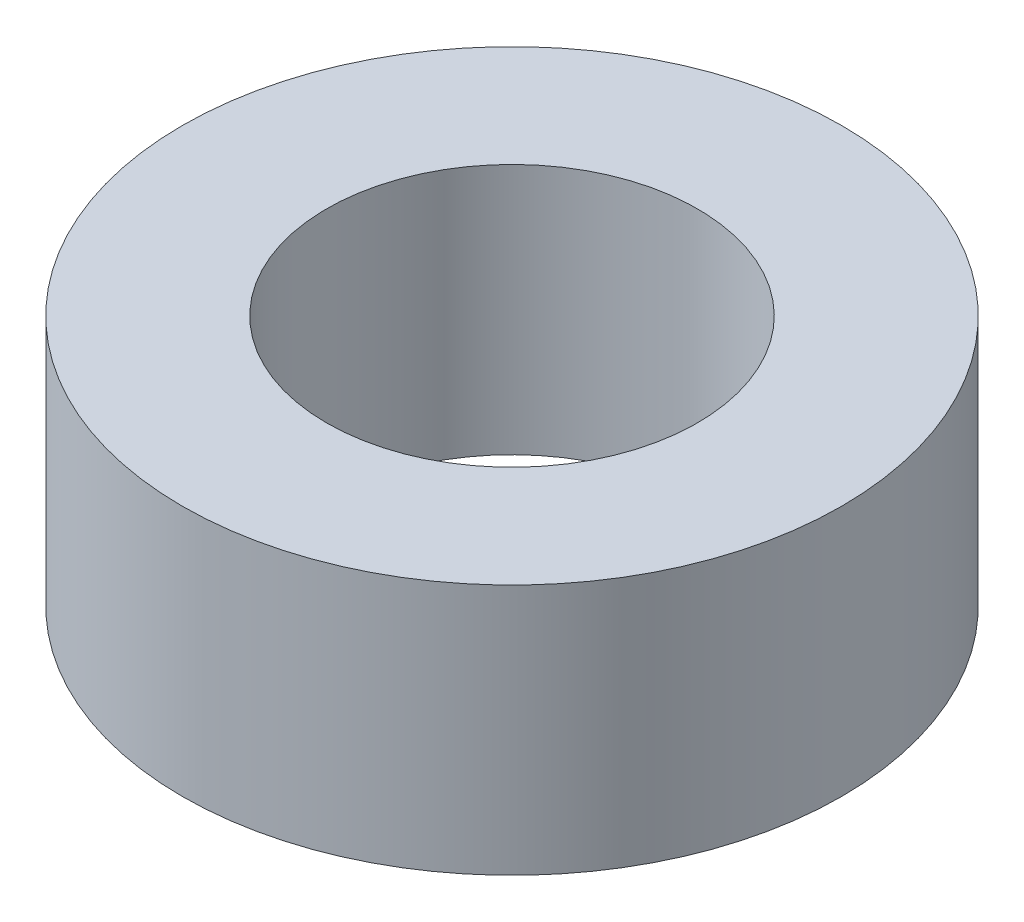
from build123d import *

# Parameters (mm, degrees)
SKETCH_1_R      = 8
SKETCH_1_R_2    = 4.5
EXTRUDE_1_DEPTH = 6.1


with BuildPart() as part:
    # 草图1 → 凸台-拉伸1 (new body)
    with BuildSketch(Plane(origin=(0, 0, 0), x_dir=(1, 0, 0), z_dir=(0, 1, 0))):
        with Locations(Location((0, 0, 0), (0, 0, 270))):
            Circle(SKETCH_1_R)
        with Locations(Location((0, 0, 0), (0, 0, 270))):
            Circle(SKETCH_1_R_2, mode=Mode.SUBTRACT)
    extrude(amount=EXTRUDE_1_DEPTH)


solid = part.part
